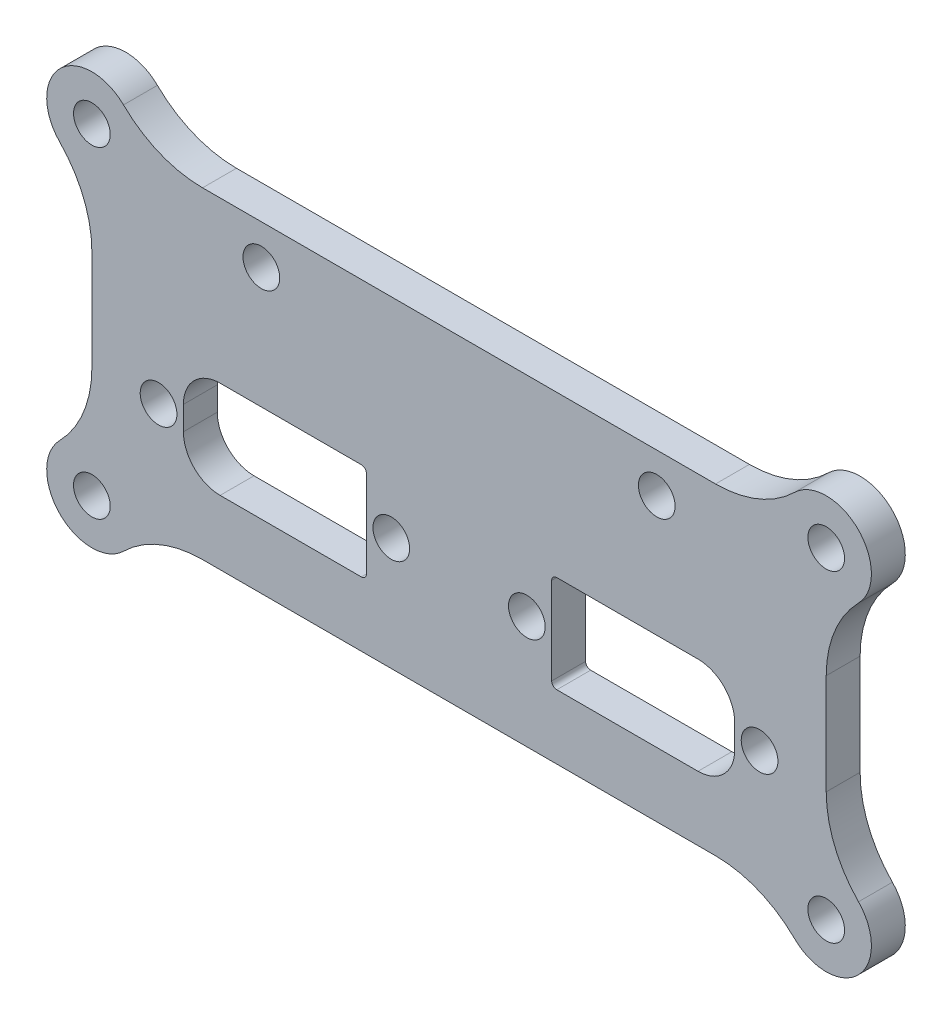
from build123d import *

# Parameters (mm, degrees)
SKETCH_1_R          = 1.625
EXTRUDE_1_DEPTH     = 3
FILLET_1_R          = 10
SKETCH_3_R          = 1.625
CUT_EXTRUDE_1_DEPTH = 10
CUT_EXTRUDE_2_DEPTH = 10
SKETCH_5_R          = 1.625
CUT_EXTRUDE_3_DEPTH = 10


with BuildPart() as part:
    # Эскиз1 → Бобышка-Вытянуть1 (new body)
    with BuildSketch(Plane.XY):
        with BuildLine():
            ThreePointArc((-32.5, 4), (-35.328427125, -2.828427125), (-28.5, 0))
            Line((-28.5, 0), (28.5, 0))
            ThreePointArc((28.5, 0), (35.328427125, -2.828427125), (32.5, 4))
            Line((32.5, 4), (32.5, 24.5))
            ThreePointArc((32.5, 24.5), (35.328427125, 31.328427125), (28.5, 28.5))
            Line((28.5, 28.5), (-28.5, 28.5))
            ThreePointArc((-28.5, 28.5), (-35.328427125, 31.328427125), (-32.5, 24.5))
            Line((-32.5, 24.5), (-32.5, 4))
        make_face()
        with Locations((-32.5, 0)):
            Circle(SKETCH_1_R, mode=Mode.SUBTRACT)
        with Locations((32.5, 28.5)):
            Circle(SKETCH_1_R, mode=Mode.SUBTRACT)
        with Locations((-32.5, 28.5)):
            Circle(SKETCH_1_R, mode=Mode.SUBTRACT)
        with Locations((32.5, 0)):
            Circle(SKETCH_1_R, mode=Mode.SUBTRACT)
    extrude(amount=EXTRUDE_1_DEPTH)

    # Скругление1
    fillet_1_edges = [part.edges().sort_by_distance(p)[0] for p in [
        (28.5, 0, 1.5),
        (-28.5, 0, 1.5),
        (-32.5, 4, 1.5),
        (-32.5, 24.5, 1.5),
        (-28.5, 28.5, 1.5),
        (28.5, 28.5, 1.5),
        (32.5, 24.5, 1.5),
        (32.5, 4, 1.5),
    ]]
    fillet(fillet_1_edges, radius=FILLET_1_R)

    # Эскиз3 → Вырез-Вытянуть1 (cut)
    with BuildSketch(Plane(origin=(0, 0, 0), x_dir=(-1, 0, 0), z_dir=(0, 0, -1))):
        with Locations((-17.5, 25)):
            Circle(SKETCH_3_R)
        with Locations(Location((17.5, 25, 0), (0, 0, 180))):
            Circle(SKETCH_3_R)
    extrude(amount=-CUT_EXTRUDE_1_DEPTH, mode=Mode.SUBTRACT)

    # Эскиз4 → Вырез-Вытянуть2 (cut)
    # profile 1 of 2: a face of its own
    with BuildSketch(Plane.XY.offset(3)):
        with BuildLine():
            Line((-8.2, 6.15), (-8.2, 13.85))
            ThreePointArc((-8.2, 13.85), (-8.331801948, 14.168198052), (-8.65, 14.3))
            Line((-8.65, 14.3), (-21.15, 14.3))
            ThreePointArc((-21.15, 14.3), (-23.448097039, 13.348097039), (-24.4, 11.05))
            Line((-24.4, 11.05), (-24.4, 8.95))
            ThreePointArc((-24.4, 8.95), (-23.448097039, 6.651902961), (-21.15, 5.7))
            Line((-21.15, 5.7), (-8.65, 5.7))
            ThreePointArc((-8.65, 5.7), (-8.331801948, 5.831801948), (-8.2, 6.15))
        make_face()
        with BuildLine():
            ThreePointArc((-21.15, 14.05), (-23.271320344, 13.171320344), (-24.15, 11.05))
            Line((-24.15, 11.05), (-24.15, 8.95))
            ThreePointArc((-24.15, 8.95), (-23.271320344, 6.828679656), (-21.15, 5.95))
            Line((-21.15, 5.95), (-8.65, 5.95))
            ThreePointArc((-8.65, 5.95), (-8.508578644, 6.008578644), (-8.45, 6.15))
            Line((-8.45, 6.15), (-8.45, 13.85))
            ThreePointArc((-8.45, 13.85), (-8.508578644, 13.991421356), (-8.65, 14.05))
            Line((-8.65, 14.05), (-21.15, 14.05))
        make_face(mode=Mode.SUBTRACT)
    # profile 2 of 2: a face of its own
    with BuildSketch(Plane.XY.offset(3)):
        with BuildLine():
            ThreePointArc((8.65, 5.7), (8.331801948, 5.831801948), (8.2, 6.15))
            Line((8.2, 6.15), (8.2, 13.85))
            ThreePointArc((8.2, 13.85), (8.331801948, 14.168198052), (8.65, 14.3))
            Line((8.65, 14.3), (21.15, 14.3))
            ThreePointArc((21.15, 14.3), (23.448097039, 13.348097039), (24.4, 11.05))
            Line((24.4, 11.05), (24.4, 8.95))
            ThreePointArc((24.4, 8.95), (23.448097039, 6.651902961), (21.15, 5.7))
            Line((21.15, 5.7), (8.65, 5.7))
        make_face()
        with BuildLine():
            Line((8.45, 6.15), (8.45, 13.85))
            ThreePointArc((8.45, 13.85), (8.508578644, 13.991421356), (8.65, 14.05))
            Line((8.65, 14.05), (21.15, 14.05))
            ThreePointArc((21.15, 14.05), (23.271320344, 13.171320344), (24.15, 11.05))
            Line((24.15, 11.05), (24.15, 8.95))
            ThreePointArc((24.15, 8.95), (23.271320344, 6.828679656), (21.15, 5.95))
            Line((21.15, 5.95), (8.65, 5.95))
            ThreePointArc((8.65, 5.95), (8.508578644, 6.008578644), (8.45, 6.15))
        make_face(mode=Mode.SUBTRACT)
    extrude(amount=-CUT_EXTRUDE_2_DEPTH, mode=Mode.SUBTRACT)


with BuildPart() as body_2:
    # of the pieces the cut leaves, the one that is kept (cut_extrude_2_keep)
    add(part.part.solids().sort_by_distance((-32.5, 18.702041029, 0))[0])

    # Эскиз5 → Вырез-Вытянуть3 (cut)
    with BuildSketch(Plane(origin=(0, 0, 0), x_dir=(-1, 0, 0), z_dir=(0, 0, -1))):
        with Locations((26.6, 10)):
            Circle(SKETCH_5_R)
        with Locations((-26.6, 10)):
            Circle(SKETCH_5_R)
        with Locations((-6, 10)):
            Circle(SKETCH_5_R)
        with Locations((6, 10)):
            Circle(SKETCH_5_R)
    extrude(amount=-CUT_EXTRUDE_3_DEPTH, mode=Mode.SUBTRACT)


solid = body_2.part
